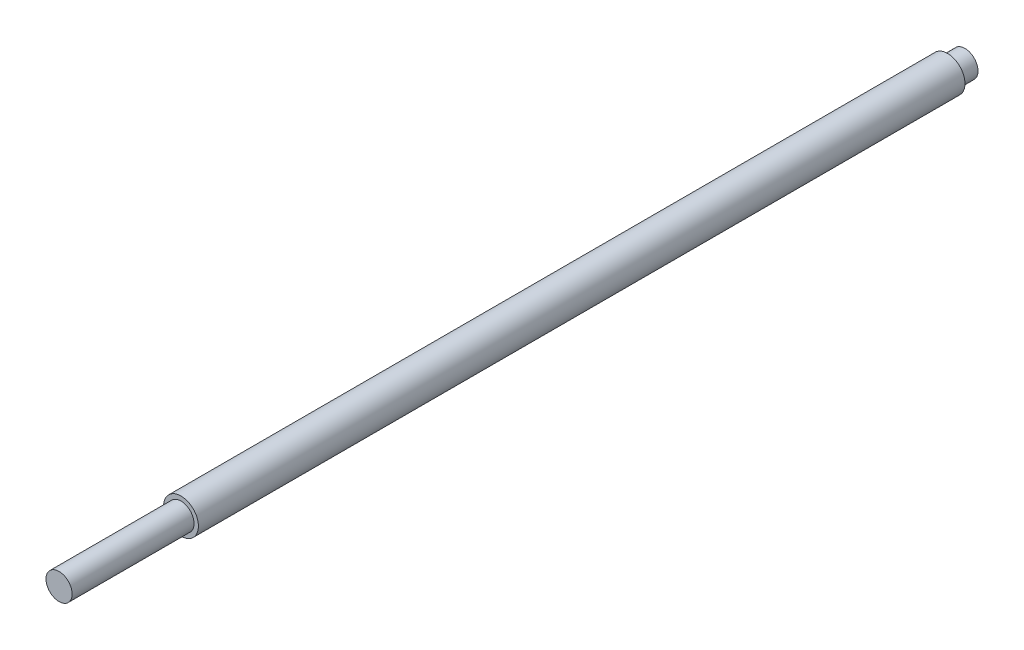
from build123d import *

# Parameters (mm, degrees)
SKETCH1_R           = 6.35
BOSS_EXTRUDE1_DEPTH = 330.2
CUT_EXTRUDE1_START  = -44.45
SKETCH2_R           = 6.35
SKETCH2_R_2         = 4.7625
CUT_EXTRUDE1_DEPTH  = 44.45
SKETCH3_R           = 6.35
SKETCH3_R_2         = 4.7625
CUT_EXTRUDE2_DEPTH  = 6.35


with BuildPart() as part:
    # Sketch1 → Boss-Extrude1 (new body)
    with BuildSketch(Plane.XY):
        Circle(SKETCH1_R)
    extrude(amount=BOSS_EXTRUDE1_DEPTH)

    # Sketch2 → Cut-Extrude1 (cut)
    with BuildSketch(Plane.XY.offset(330.2).offset(CUT_EXTRUDE1_START)):
        Circle(SKETCH2_R)
        Circle(SKETCH2_R_2, mode=Mode.SUBTRACT)
    extrude(amount=CUT_EXTRUDE1_DEPTH, mode=Mode.SUBTRACT)

    # Sketch3 → Cut-Extrude2 (cut)
    with BuildSketch(Plane(origin=(0, 0, 0), x_dir=(-1, 0, 0), z_dir=(0, 0, -1))):
        Circle(SKETCH3_R)
        Circle(SKETCH3_R_2, mode=Mode.SUBTRACT)
    extrude(amount=-CUT_EXTRUDE2_DEPTH, mode=Mode.SUBTRACT)


solid = part.part
